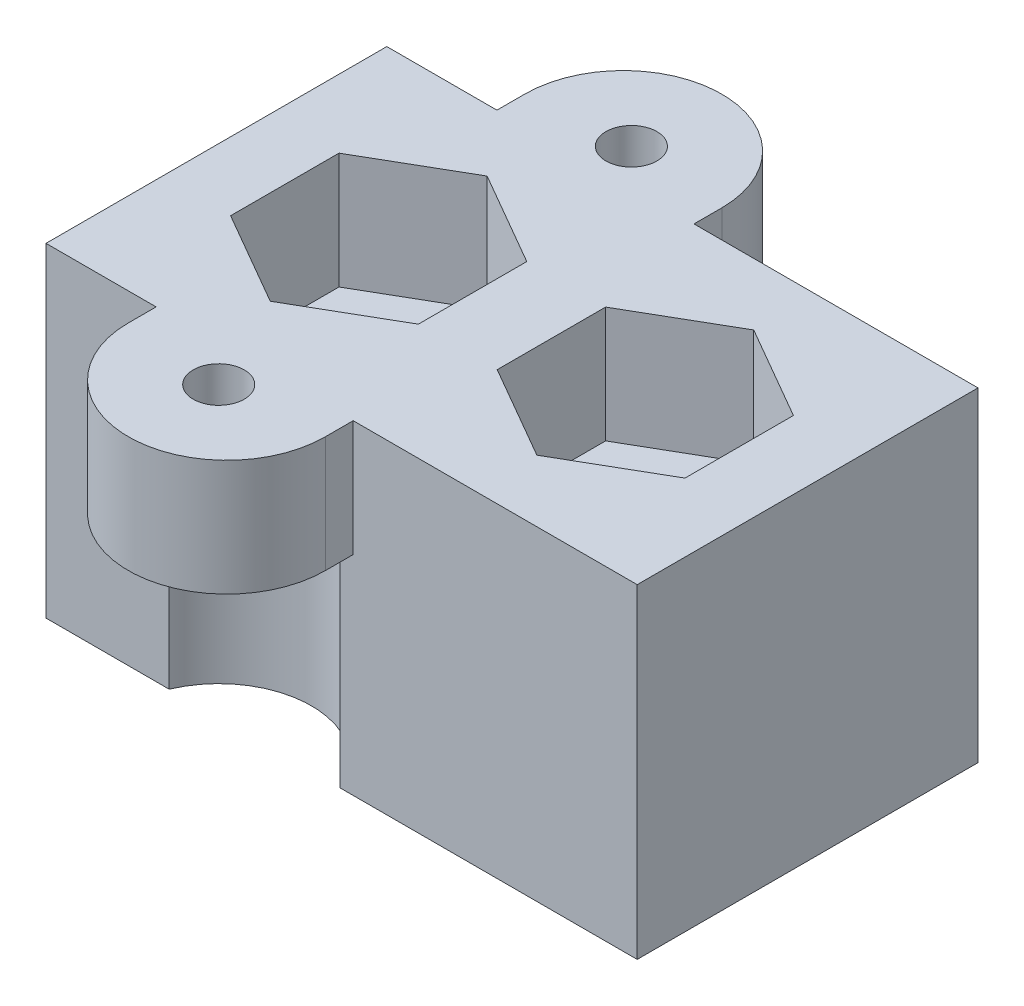
from build123d import *

# Parameters (mm, degrees)
SKETCH_1_W                    = 25.5
SKETCH_1_H                    = 14.7
EXTRUDE_385_DEPTH             = 14
SKETCH_4_W                    = 8.5
SKETCH_4_H                    = 5.45
EXTRUDE_2_DEPTH               = 5
FILLET_1_RADIUS               = 4.25
FILLET_1_LENGTH               = 5
HOLE_WIZARD_M2_1_D            = 2.2
SKETCH_7_R                    = 4
CUT_EXTRUDE_3_DEPTH           = 9
FILLET_1_OF_MIRROR_1_2_RADIUS = 4.25
FILLET_1_OF_MIRROR_1_2_LENGTH = 5
HOLE_WIZARD_M5_1_D            = 5.3
CUT_EXTRUDE_4_DEPTH           = 5


with BuildPart() as part:
    # 草图1 → Extrude 385 (new body)
    with BuildSketch(Plane(origin=(0, 0, 0), x_dir=(1, 0, 0), z_dir=(0, 1, 0))):
        with Locations((16.790583128, 0)):
            Rectangle(SKETCH_1_W, SKETCH_1_H)
    extrude(amount=EXTRUDE_385_DEPTH)

    # 草图4 → 凸台-拉伸2 (add)
    with BuildSketch(Plane.XZ.offset(-14)):
        with Locations((13.040583128, -10.075)):
            Rectangle(SKETCH_4_W, SKETCH_4_H)
    extrude_2 = extrude(amount=EXTRUDE_2_DEPTH)

    # 圆角1: full round fillet: the end face becomes a half cylinder, R = half its width
    fillet_1_face = Plane((13.040583128, 11.5, -12.8), x_dir=(0, 1, 0), z_dir=(0, 0, -1))  # on the end face: x along it, z out of the body
    fillet_1_slab = fillet_1_face.offset(-FILLET_1_RADIUS / 2) * Box(FILLET_1_LENGTH, 2 * FILLET_1_RADIUS, FILLET_1_RADIUS, mode=Mode.PRIVATE)  # the body's end, R deep
    fillet_1_round = Plane((13.040583128, 11.5, -8.55), x_dir=(0, 0, -1), z_dir=(0, 1, 0)) * Cylinder(FILLET_1_RADIUS, FILLET_1_LENGTH, mode=Mode.PRIVATE)  # its axis R under the face
    add(fillet_1_slab - fillet_1_round, mode=Mode.SUBTRACT)

    # M2 间隙孔1 (through all)
    with Locations(Plane(origin=(0, 9, 0), x_dir=(-1, 0, 0), z_dir=(0, -1, 0))):
        with Locations((-13.040583128, 8.9)):
            hole_wizard_m2_1 = Hole(HOLE_WIZARD_M2_1_D / 2)

    # 草图7 → 切除-拉伸3 (cut)
    with BuildSketch(Plane.XZ):
        with Locations((13.040583128, -8.9)):
            Circle(SKETCH_7_R)
    cut_extrude_3 = extrude(amount=-CUT_EXTRUDE_3_DEPTH, mode=Mode.SUBTRACT)

    # 镜向1: 凸台-拉伸2, M2 间隙孔1, 切除-拉伸3 across plane
    add(extrude_2.mirror(Plane.XY))
    add(hole_wizard_m2_1.mirror(Plane.XY), mode=Mode.SUBTRACT)
    add(cut_extrude_3.mirror(Plane.XY), mode=Mode.SUBTRACT)

    # 圆角1 of Mirror 1 2: full round fillet: the end face becomes a half cylinder, R = half its width
    fillet_1_of_mirror_1_2_face = Plane((13.040583128, 11.5, 12.8), x_dir=(0, 1, 0), z_dir=(0, 0, 1))  # on the end face: x along it, z out of the body
    fillet_1_of_mirror_1_2_slab = fillet_1_of_mirror_1_2_face.offset(-FILLET_1_OF_MIRROR_1_2_RADIUS / 2) * Box(FILLET_1_OF_MIRROR_1_2_LENGTH, 2 * FILLET_1_OF_MIRROR_1_2_RADIUS, FILLET_1_OF_MIRROR_1_2_RADIUS, mode=Mode.PRIVATE)  # the body's end, R deep
    fillet_1_of_mirror_1_2_round = Plane((13.040583128, 11.5, 8.55), x_dir=(0, 0, 1), z_dir=(0, 1, 0)) * Cylinder(FILLET_1_OF_MIRROR_1_2_RADIUS, FILLET_1_OF_MIRROR_1_2_LENGTH, mode=Mode.PRIVATE)  # its axis R under the face
    add(fillet_1_of_mirror_1_2_slab - fillet_1_of_mirror_1_2_round, mode=Mode.SUBTRACT)

    # M5 间隙孔1 (through all)
    with Locations(Plane(origin=(0, 0, 0), x_dir=(-1, 0, 0), z_dir=(0, -1, 0))):
        with Locations((-22.540583128, 0), (-11.040583128, 0)):
            Hole(HOLE_WIZARD_M5_1_D / 2)

    # 草图10 → 切除-拉伸4 (cut)
    with BuildSketch(Plane(origin=(0, 14, 0), x_dir=(1, 0, 0), z_dir=(0, 1, 0))):
        Polygon((11.040583128, 4.67653718), (6.990583128, 2.33826859), (6.990583128, -2.33826859), (11.040583128, -4.67653718), (15.090583128, -2.33826859), (15.090583128, 2.33826859), align=None)
        Polygon((22.540583128, 4.67653718), (18.490583128, 2.33826859), (18.490583128, -2.33826859), (22.540583128, -4.67653718), (26.590583128, -2.33826859), (26.590583128, 2.33826859), align=None)
    extrude(amount=-CUT_EXTRUDE_4_DEPTH, mode=Mode.SUBTRACT)


solid = part.part
